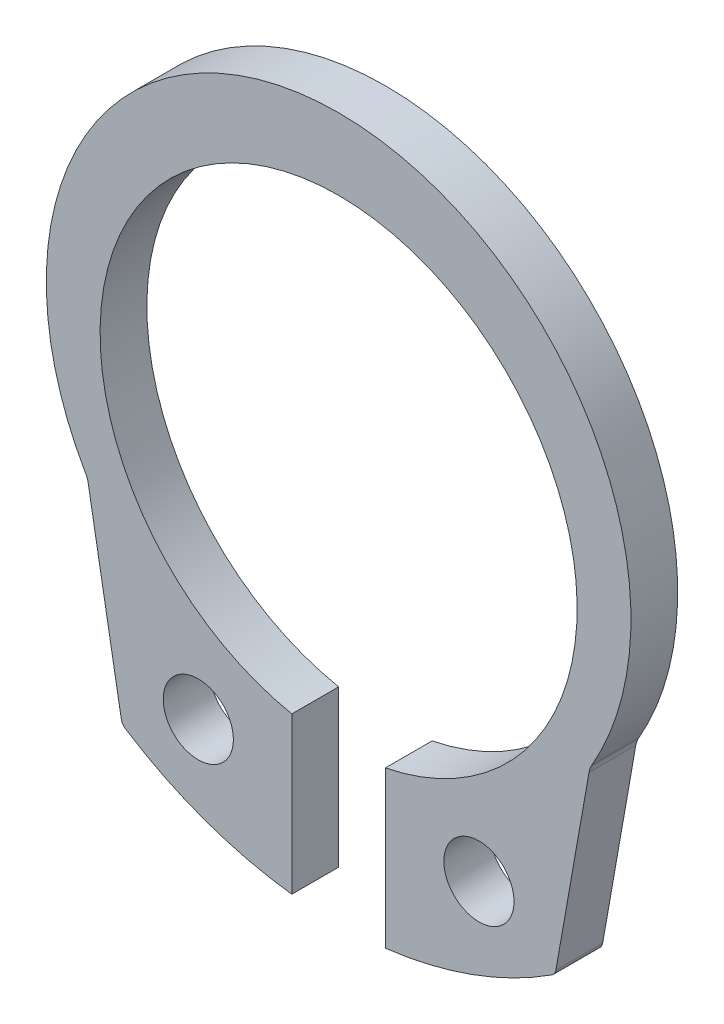
from build123d import *

# Parameters (mm, degrees)
SKETCH1_R  = 0.75
BODY_DEPTH = 1
FILLET1_R  = 0.2
FILLET2_R  = 0.5


with BuildPart() as part:
    # Sketch1 → Body (new body)
    with BuildSketch(Plane.XY):
        with BuildLine():
            Line((-1, -5.3809999), (-1, -8.720263785))
            ThreePointArc((-1, -8.720263785), (-2.893008296, -8.266095548), (-4.630634281, -7.388368295))
            Line((-4.630634281, -7.388368295), (-5.369365719, -3.19881412))
            ThreePointArc((-5.369365719, -3.19881412), (0, 6.25), (5.369365719, -3.19881412))
            Line((5.369365719, -3.19881412), (4.630634281, -7.388368295))
            ThreePointArc((4.630634281, -7.388368295), (2.893008296, -8.266095548), (1, -8.720263785))
            Line((1, -8.720263785), (1, -5.3809999))
            ThreePointArc((1, -5.3809999), (0, 4.72), (-1, -5.3809999))
        make_face()
        with Locations(Location((3, -6.482458521, 0), (0, 0, 180))):
            Circle(SKETCH1_R, mode=Mode.SUBTRACT)
        with Locations((-3, -6.482458521)):
            Circle(SKETCH1_R, mode=Mode.SUBTRACT)
    extrude(amount=-BODY_DEPTH)

    # Fillet1
    fillet1_edges = [part.edges().sort_by_distance(p)[0] for p in [
        (-4.630634281, -7.388368295, -0.5),
        (4.630634281, -7.388368295, -0.5),
    ]]
    fillet(fillet1_edges, radius=FILLET1_R)

    # Fillet2
    fillet2_edges = [part.edges().sort_by_distance(p)[0] for p in [
        (-5.369365719, -3.19881412, -0.5),
        (5.369365719, -3.19881412, -0.5),
    ]]
    fillet(fillet2_edges, radius=FILLET2_R)


solid = part.part
